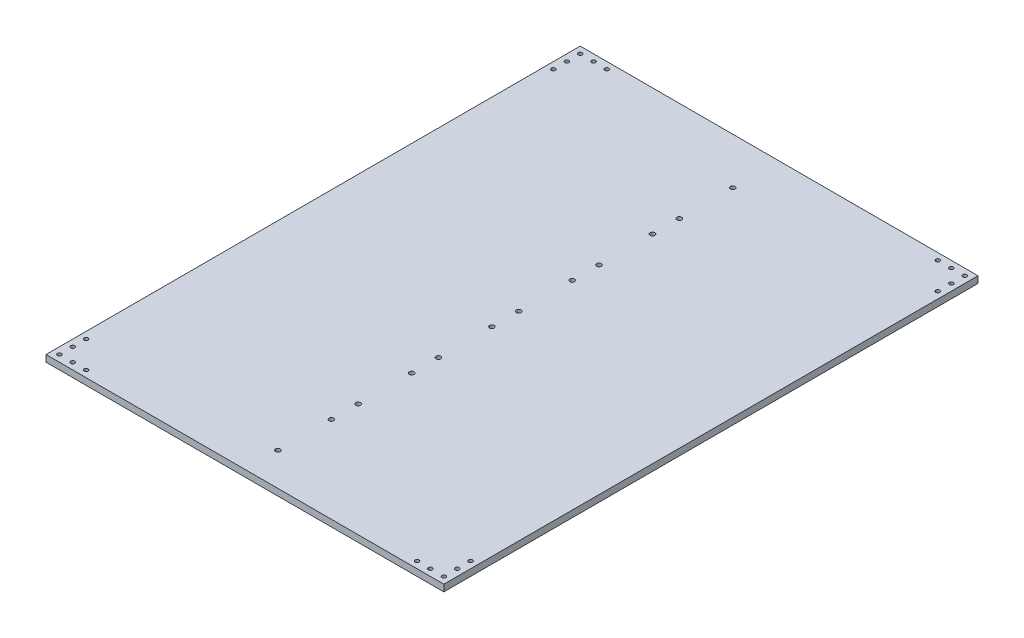
from build123d import *

# Parameters (mm, degrees)
SKETCH1_W           = 297.5
SKETCH1_H           = 399.5
BOSS_EXTRUDE1_DEPTH = 5
SKETCH3_R           = 1.749864578
SKETCH3_R_2         = 1.750391844
SKETCH3_R_3         = 1.750224182
SKETCH3_R_4         = 1.74961836
SKETCH3_R_5         = 1.75096205
SKETCH3_R_6         = 1.748620385
SKETCH3_R_7         = 1.748899818
SKETCH3_R_8         = 1.749915058
SKETCH3_R_9         = 1.748890378
SKETCH3_R_10        = 1.750988741
SKETCH3_R_11        = 1.752219163
CUT_EXTRUDE2_DEPTH  = 10
SKETCH5_R           = 1.5
CUT_EXTRUDE3_DEPTH  = 10


with BuildPart() as part:
    # Sketch1 → Boss-Extrude1 (new body)
    with BuildSketch(Plane(origin=(0, 0, 0), x_dir=(1, 0, 0), z_dir=(0, 1, 0))):
        with Locations((148.75, 199.75)):
            Rectangle(SKETCH1_W, SKETCH1_H)
    extrude(amount=BOSS_EXTRUDE1_DEPTH)

    # Sketch3 → Cut-Extrude2 (cut)
    with BuildSketch(Plane(origin=(0, 5, 0), x_dir=(1, 0, 0), z_dir=(0, 1, 0))):
        with Locations(Location((148.748083814, 24.684748422, 0), (0, 0, 270))):
            Circle(SKETCH3_R)
        with Locations(Location((148.748340036, 64.683726641, 0), (0, 0, 270))):
            Circle(SKETCH3_R_2)
        with Locations(Location((148.75044634, 84.720729049, 0), (0, 0, 270))):
            Circle(SKETCH3_R_3)
        with Locations(Location((148.748021994, 124.721020588, 0), (0, 0, 270))):
            Circle(SKETCH3_R_4)
        with Locations(Location((148.749007517, 144.750094856, 0), (0, 0, 270))):
            Circle(SKETCH3_R_5)
        with Locations(Location((148.747543438, 184.752595185, 0), (0, 0, 270))):
            Circle(SKETCH3_R_6)
        with Locations(Location((148.747015223, 204.786810925, 0), (0, 0, 270))):
            Circle(SKETCH3_R_7)
        with Locations(Location((148.748242067, 244.786829837, 0), (0, 0, 270))):
            Circle(SKETCH3_R_8)
        with Locations(Location((148.746998642, 264.816839038, 0), (0, 0, 270))):
            Circle(SKETCH3_R_9)
        with Locations(Location((148.750231988, 304.815858705, 0), (0, 0, 270))):
            Circle(SKETCH3_R_10)
        with Locations(Location((148.747015223, 324.852824112, 0), (0, 0, 270))):
            Circle(SKETCH3_R_7)
        with Locations(Location((148.751036789, 364.852854296, 0), (0, 0, 270))):
            Circle(SKETCH3_R_11)
    extrude(amount=-CUT_EXTRUDE2_DEPTH, mode=Mode.SUBTRACT)

    # Sketch5 → Cut-Extrude3 (cut)
    with BuildSketch(Plane(origin=(0, 5, 0), x_dir=(1, 0, 0), z_dir=(0, 1, 0))):
        with Locations(Location((272.5, 5, 0), (0, 0, 270))):
            Circle(SKETCH5_R)
        with Locations(Location((282.5, 5, 0), (0, 0, 270))):
            Circle(SKETCH5_R)
        with Locations(Location((292.5, 5, 0), (0, 0, 270))):
            Circle(SKETCH5_R)
        with Locations(Location((292.5, 15, 0), (0, 0, 270))):
            Circle(SKETCH5_R)
        with Locations(Location((292.5, 25, 0), (0, 0, 270))):
            Circle(SKETCH5_R)
        with Locations(Location((292.5, 374.5, 0), (0, 0, 270))):
            Circle(SKETCH5_R)
        with Locations(Location((292.5, 384.5, 0), (0, 0, 270))):
            Circle(SKETCH5_R)
        with Locations(Location((292.5, 394.5, 0), (0, 0, 270))):
            Circle(SKETCH5_R)
        with Locations(Location((282.5, 394.5, 0), (0, 0, 270))):
            Circle(SKETCH5_R)
        with Locations(Location((272.5, 394.5, 0), (0, 0, 270))):
            Circle(SKETCH5_R)
        with Locations(Location((5, 374.5, 0), (0, 0, 270))):
            Circle(SKETCH5_R)
        with Locations(Location((5, 384.5, 0), (0, 0, 270))):
            Circle(SKETCH5_R)
        with Locations(Location((5, 394.5, 0), (0, 0, 270))):
            Circle(SKETCH5_R)
        with Locations(Location((15, 394.5, 0), (0, 0, 270))):
            Circle(SKETCH5_R)
        with Locations(Location((25, 394.5, 0), (0, 0, 270))):
            Circle(SKETCH5_R)
        with Locations(Location((25, 5, 0), (0, 0, 270))):
            Circle(SKETCH5_R)
        with Locations(Location((15, 5, 0), (0, 0, 270))):
            Circle(SKETCH5_R)
        with Locations(Location((5, 5, 0), (0, 0, 270))):
            Circle(SKETCH5_R)
        with Locations(Location((5, 15, 0), (0, 0, 270))):
            Circle(SKETCH5_R)
        with Locations(Location((5, 25, 0), (0, 0, 270))):
            Circle(SKETCH5_R)
    extrude(amount=-CUT_EXTRUDE3_DEPTH, mode=Mode.SUBTRACT)


solid = part.part
